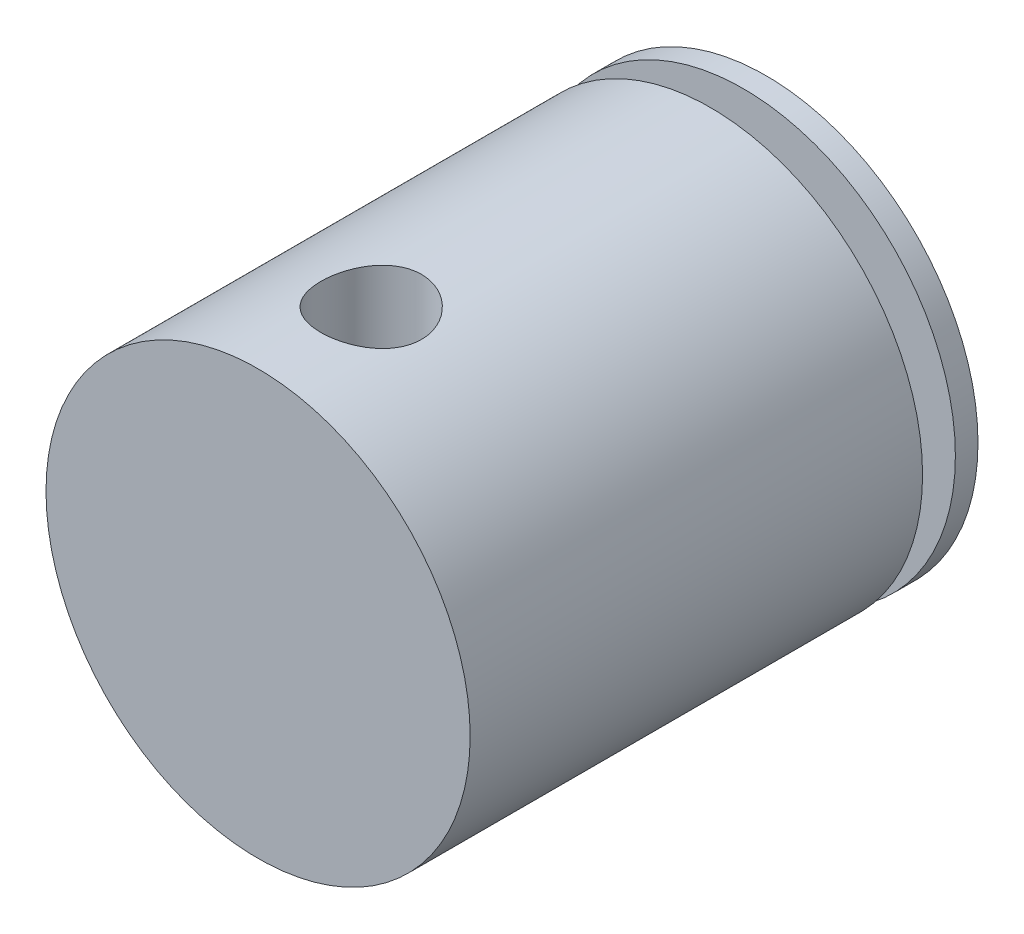
from build123d import *

# Parameters (mm, degrees)
SKETCH1_R               = 4.7625
BOSS_EXTRUDE1_DEPTH     = 5.08
SKETCH2_R               = 2.667
BOSS_EXTRUDE2_DEPTH     = 0.7366
SKETCH3_R               = 4.7625
BOSS_EXTRUDE3_DEPTH     = 5.08
CUT_EXTRUDE1_DEPTH      = 6.35
CUT_EXTRUDE1_DEPTH_BACK = 6.35
SKETCH6_R               = 1.1303
SKETCH7_R               = 3.5000057
CUT_EXTRUDE2_DEPTH      = 2.50000008
SKETCH8_R               = 1.999996
CUT_EXTRUDE3_DEPTH      = 10.0000054
SKETCH9_R               = 4.7625
CUT_EXTRUDE4_DEPTH      = 4.572
SKETCH10_R              = 1.999996
CUT_EXTRUDE5_DEPTH      = 10.0000054


with BuildPart() as part:
    # Sketch1 → Boss-Extrude1 (new body)
    with BuildSketch(Plane.XY):
        Circle(SKETCH1_R)
    extrude(amount=BOSS_EXTRUDE1_DEPTH)

    # Sketch2 → Boss-Extrude2 (add)
    with BuildSketch(Plane.XY.offset(5.08)):
        Circle(SKETCH2_R)
    extrude(amount=BOSS_EXTRUDE2_DEPTH)

    # Sketch3 → Boss-Extrude3 (add)
    with BuildSketch(Plane.XY.offset(5.8166)):
        Circle(SKETCH3_R)
    boss_extrude3 = extrude(amount=BOSS_EXTRUDE3_DEPTH)

    # Mirror3: Boss-Extrude3 across plane
    add(boss_extrude3.mirror(Plane.XY.offset(10.8966)))

    # Sketch6 → Cut-Extrude1 (cut, two sides: drawn at the far end of the back side and taken through both)
    with BuildSketch(Plane(origin=(0, 0, 0), x_dir=(1, 0, 0), z_dir=(0, 1, 0)).offset(-CUT_EXTRUDE1_DEPTH_BACK)):
        with Locations(Location((0, -13.4366, 0), (0, 0, 90))):
            Circle(SKETCH6_R)
    extrude(amount=CUT_EXTRUDE1_DEPTH + CUT_EXTRUDE1_DEPTH_BACK, mode=Mode.SUBTRACT)

    # Sketch7 → Cut-Extrude2 (cut)
    with BuildSketch(Plane(origin=(0, 0, 0), x_dir=(-1, 0, 0), z_dir=(0, 0, -1))):
        Circle(SKETCH7_R)
    extrude(amount=-CUT_EXTRUDE2_DEPTH, mode=Mode.SUBTRACT)

    # Sketch8 → Cut-Extrude3 (cut)
    with BuildSketch(Plane(origin=(0, 0, 2.50000008), x_dir=(-1, 0, 0), z_dir=(0, 0, -1))):
        Circle(SKETCH8_R)
    extrude(amount=-CUT_EXTRUDE3_DEPTH, mode=Mode.SUBTRACT)

    # Sketch9 → Cut-Extrude4 (cut)
    with BuildSketch(Plane(origin=(0, 0, 0), x_dir=(-1, 0, 0), z_dir=(0, 0, -1))):
        Circle(SKETCH9_R)
    extrude(amount=-CUT_EXTRUDE4_DEPTH, mode=Mode.SUBTRACT)

    # Sketch10 → Cut-Extrude5 (cut)
    with BuildSketch(Plane(origin=(0, 0, 4.572), x_dir=(-1, 0, 0), z_dir=(0, 0, -1))):
        Circle(SKETCH10_R)
    extrude(amount=-CUT_EXTRUDE5_DEPTH, mode=Mode.SUBTRACT)


solid = part.part
